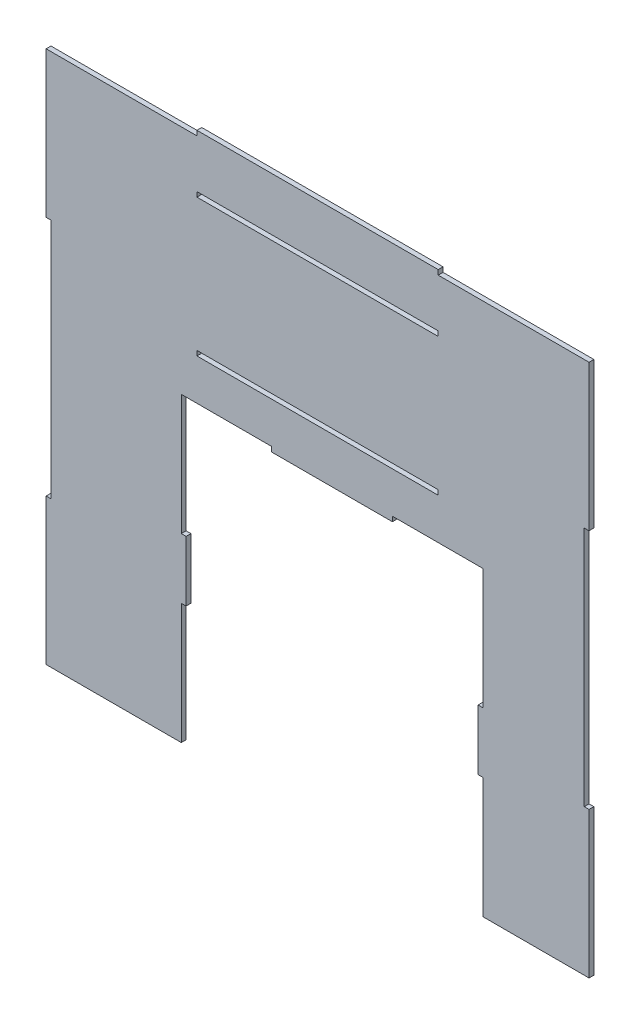
from build123d import *

# Parameters (mm, degrees)
SKETCH1_W           = 200
SKETCH1_H           = 4
BOSS_EXTRUDE1_DEPTH = 4


with BuildPart() as part:
    # Sketch1 → Boss-Extrude1 (new body)
    with BuildSketch(Plane.XY):
        Polygon((-268.2019237, -98.094032778), (-268.2019237, -219.094032778), (-156.2019237, -219.094032778), (-156.2019237, -119.094032778), (-152.2019237, -119.094032778), (-152.2019237, -69.094032778), (-156.2019237, -69.094032778), (-156.2019237, 30.905967222), (-81.2019237, 30.905967222), (-81.2019237, 26.905967222), (18.7980763, 26.905967222), (18.7980763, 30.905967222), (93.7980763, 30.905967222), (93.7980763, -69.094032778), (89.7980763, -69.094032778), (89.7980763, -119.094032778), (93.7980763, -119.094032778), (93.7980763, -219.094032778), (181.7980763, -219.094032778), (181.7980763, -98.094032778), (177.7980763, -98.094032778), (177.7980763, 101.905967222), (181.7980763, 101.905967222), (181.7980763, 222.905967222), (56.7980763, 222.905967222), (56.7980763, 226.905967222), (-143.2019237, 226.905967222), (-143.2019237, 222.905967222), (-268.2019237, 222.905967222), (-268.2019237, 101.905967222), (-264.2019237, 101.905967222), (-264.2019237, -98.094032778), align=None)
        with Locations((-43.2019237, 66.905967222)):
            Rectangle(SKETCH1_W, SKETCH1_H, mode=Mode.SUBTRACT)
        with Locations((-43.2019237, 180.905967222)):
            Rectangle(SKETCH1_W, SKETCH1_H, mode=Mode.SUBTRACT)
    extrude(amount=BOSS_EXTRUDE1_DEPTH)


solid = part.part
